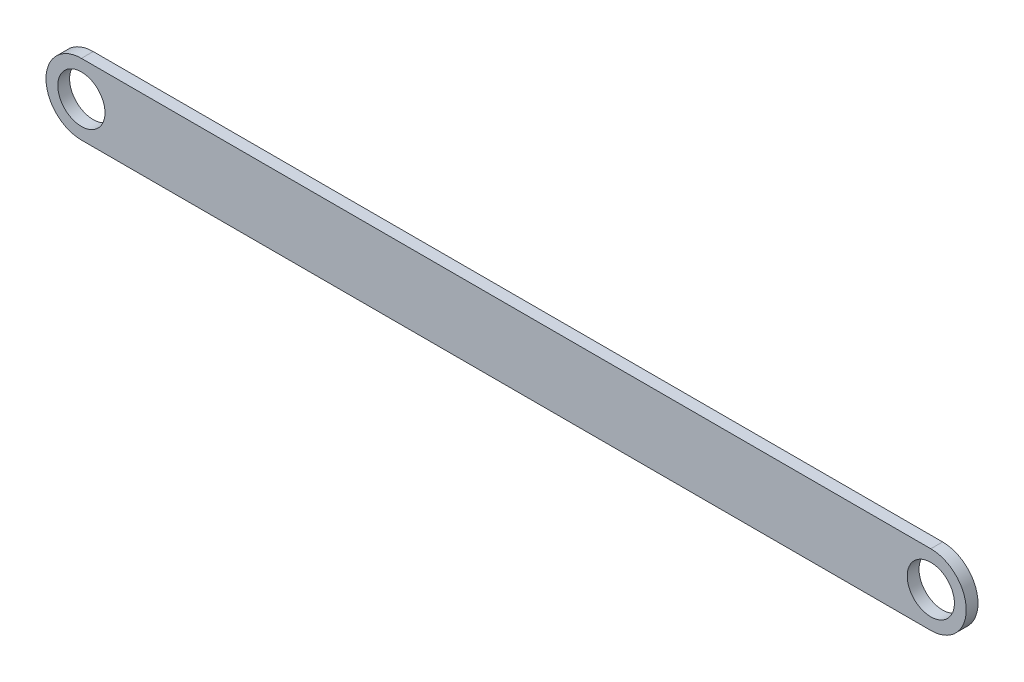
from build123d import *

# Parameters (mm, degrees)
SALIENTE_EXTRUIR1_DEPTH = 2.5
CROQUIS3_R              = 5
CORTAR_EXTRUIR1_DEPTH   = 98.819987733


with BuildPart() as part:
    # Croquis2 → Saliente-Extruir1 (new body)
    with BuildSketch(Plane.XY):
        with BuildLine():
            Line((-90, 7.5), (90, 7.5))
            ThreePointArc((90, 7.5), (97.5, 0), (90, -7.5))
            Line((90, -7.5), (-90, -7.5))
            ThreePointArc((-90, -7.5), (-97.5, 0), (-90, 7.5))
        make_face()
    extrude(amount=SALIENTE_EXTRUIR1_DEPTH)

    # Croquis3 → Cortar-Extruir1 (cut, through all)
    with BuildSketch(Plane.XY.offset(2.5)):
        with Locations((-90, 0)):
            Circle(CROQUIS3_R)
        with Locations((90, 0)):
            Circle(CROQUIS3_R)
    extrude(amount=-CORTAR_EXTRUIR1_DEPTH, mode=Mode.SUBTRACT)


solid = part.part
